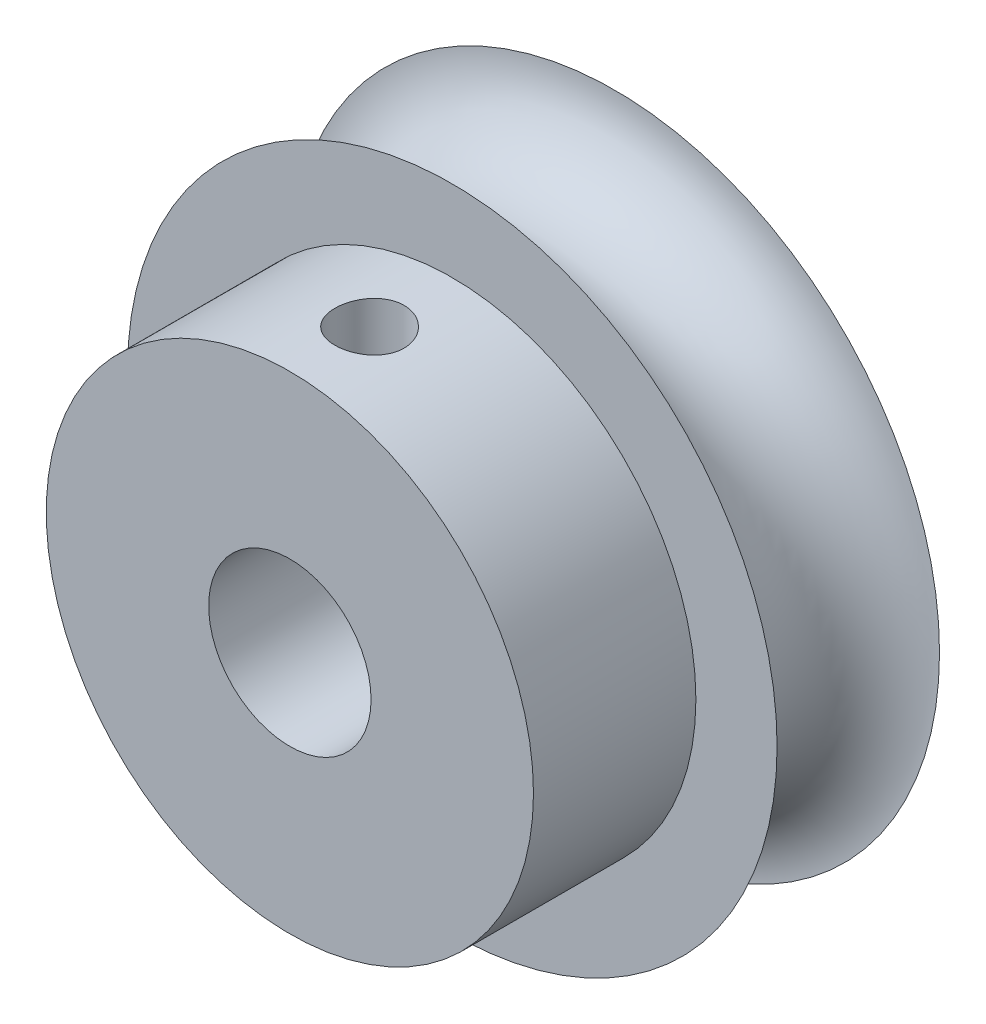
from build123d import *

# Parameters (mm, degrees)
SKETCH1_R                 = 12.7
BOSS_EXTRUDE1_DEPTH       = 6.35
SKETCH2_R                 = 9.525
BOSS_EXTRUDE2_DEPTH       = 6.35
SKETCH3_R                 = 3.175
CUT_EXTRUDE1_DEPTH        = 12.7
F_6_32_TAPPED_HOLE1_D     = 2.7051
F_6_32_TAPPED_HOLE1_DEPTH = 9.524
F_6_32_TAPPED_HOLE1_TIP   = 0.81269403


with BuildPart() as part:
    # Sketch1 → Boss-Extrude1 (new body)
    with BuildSketch(Plane.XY):
        Circle(SKETCH1_R)
    extrude(amount=BOSS_EXTRUDE1_DEPTH)

    # Sketch2 → Boss-Extrude2 (add)
    with BuildSketch(Plane.XY.offset(6.35)):
        Circle(SKETCH2_R)
    extrude(amount=BOSS_EXTRUDE2_DEPTH)

    # Sketch3 → Cut-Extrude1 (cut)
    with BuildSketch(Plane.XY.offset(12.7)):
        Circle(SKETCH3_R)
    extrude(amount=-CUT_EXTRUDE1_DEPTH, mode=Mode.SUBTRACT)

    # Sketch4 → Cut-Revolve1 (revolve, cut)
    with BuildSketch(Plane(origin=(0, 0, 0), x_dir=(1, 0, 0), z_dir=(0, 1, 0)), mode=Mode.PRIVATE) as cut_revolve1_sk:
        with BuildLine():
            Line((12.7, 0), (12.7, -6.35))
            ThreePointArc((12.7, -6.35), (9.525, -3.175), (12.7, 0))
        make_face()
    revolve(cut_revolve1_sk.sketch.rotate(Axis((0, 0, -3.575887172), (0, 0, 1)), 180), axis=Axis((0, 0, -3.575887172), (0, 0, 1)), mode=Mode.SUBTRACT)

    # #6-32 Tapped Hole1
    with Locations(Plane(origin=(-9.4e-08, 9.525, 9.584004604), x_dir=(1.0, 9.833e-09, 0), z_dir=(-9.833e-09, 1.0, 0))):
        with Locations((0, 0)):
            Hole(F_6_32_TAPPED_HOLE1_D / 2, depth=F_6_32_TAPPED_HOLE1_DEPTH)
            with Locations((0, 0, -(F_6_32_TAPPED_HOLE1_DEPTH + F_6_32_TAPPED_HOLE1_TIP / 2))):  # 118° drill point
                Cone(0, F_6_32_TAPPED_HOLE1_D / 2, F_6_32_TAPPED_HOLE1_TIP, mode=Mode.SUBTRACT)


solid = part.part
